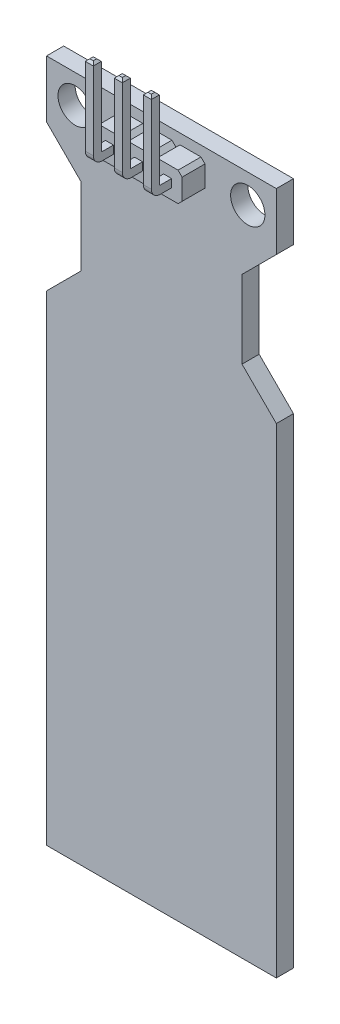
from build123d import *

# Parameters (mm, degrees)
SKETCH_1_R             = 1.5
EXTRUDE_1_DEPTH        = 1.5
EXTRUDE_2_DEPTH        = 2
SKETCH_4_W             = 0.7
SKETCH_4_H             = 0.7
EXTRUDE_3_DEPTH        = 1
EXTRUDE_4_DEPTH        = 0.7
PATTERN_LINEAR_1_COUNT = 3
PATTERN_LINEAR_1_PITCH = 2.54
CHAMFER_1_SIZE         = 0.2


with BuildPart() as part:
    # 草图1 → 凸台-拉伸1 (new body)
    with BuildSketch(Plane.XY):
        Polygon((-10.05, -29.9), (10.05, -29.9), (10.05, 12.1), (7.05, 15.1), (7.05, 21.9), (10.05, 24.9), (10.05, 29.9), (-10.05, 29.9), (-10.05, 24.9), (-7.05, 21.9), (-7.05, 15.1), (-10.05, 12.1), align=None)
        with Locations((7.55, 27.4)):
            Circle(SKETCH_1_R, mode=Mode.SUBTRACT)
        with Locations(Location((-7.55, 27.4, 0), (0, 0, 180))):
            Circle(SKETCH_1_R, mode=Mode.SUBTRACT)
    extrude(amount=EXTRUDE_1_DEPTH)

    # 草图3 → 凸台-拉伸2 (add)
    with BuildSketch(Plane.XY.offset(1.5)):
        Polygon((-3.456446609, 29), (-3.81, 28.646446609), (-3.81, 26.813553391), (-3.456446609, 26.46), (-1.623553391, 26.46), (-1.27, 26.813553391), (-0.916446609, 26.46), (0.916446609, 26.46), (1.27, 26.813553391), (1.623553391, 26.46), (3.456446609, 26.46), (3.81, 26.813553391), (3.81, 28.646446609), (3.456446609, 29), (1.623553391, 29), (1.27, 28.646446609), (0.916446609, 29), (-0.916446609, 29), (-1.27, 28.646446609), (-1.623553391, 29), align=None)
    extrude(amount=EXTRUDE_2_DEPTH)

    # 草图4 → 凸台-拉伸3 (add)
    with BuildSketch(Plane.XY.offset(3.5)):
        with Locations((-2.54, 27.73)):
            Rectangle(SKETCH_4_W, SKETCH_4_H)
        with Locations((0, 27.73)):
            Rectangle(SKETCH_4_W, SKETCH_4_H)
        with Locations((2.54, 27.73)):
            Rectangle(SKETCH_4_W, SKETCH_4_H)
    extrude(amount=EXTRUDE_3_DEPTH)

    # 草图5 → 凸台-拉伸4 (add)
    with BuildSketch(Plane(origin=(2.89, 0, 0), x_dir=(0, 0, -1), z_dir=(1, 0, 0))):
        with BuildLine():
            Line((-3.5, 27.38), (-4.5, 27.38))
            ThreePointArc((-4.5, 27.38), (-5.045144747, 27.605806348), (-5.270951094, 28.150951094))
            Line((-5.270951094, 28.150951094), (-5.270951094, 35.150951094))
            Line((-5.270951094, 35.150951094), (-4.570951094, 35.150951094))
            Line((-4.570951094, 35.150951094), (-4.570951094, 28.150951094))
            ThreePointArc((-4.570951094, 28.150951094), (-4.55017, 28.100781094), (-4.5, 28.08))
            Line((-4.5, 28.08), (-3.5, 28.08))
            Line((-3.5, 28.08), (-3.5, 27.38))
        make_face()
    extrude_4 = extrude(amount=-EXTRUDE_4_DEPTH)

    # 阵列(线性)1: 凸台-拉伸4 ×3
    with Locations(*[(-i * PATTERN_LINEAR_1_PITCH, 0, 0) for i in range(1, PATTERN_LINEAR_1_COUNT)]):
        add(extrude_4)

    # 倒角1
    chamfer_1_edges = [part.edges().sort_by_distance(p)[0] for p in [
        (2.89, 35.150951094, 4.920951094),
        (2.19, 35.150951094, 4.920951094),
        (2.54, 35.150951094, 5.270951094),
        (2.54, 35.150951094, 4.570951094),
        (0.35, 35.150951094, 4.920951094),
        (-0.35, 35.150951094, 4.920951094),
        (0, 35.150951094, 5.270951094),
        (0, 35.150951094, 4.570951094),
        (-2.89, 35.150951094, 4.920951094),
        (-2.54, 35.150951094, 5.270951094),
        (-2.54, 35.150951094, 4.570951094),
        (-2.19, 35.150951094, 4.920951094),
    ]]
    chamfer(chamfer_1_edges, length=CHAMFER_1_SIZE)


solid = part.part
